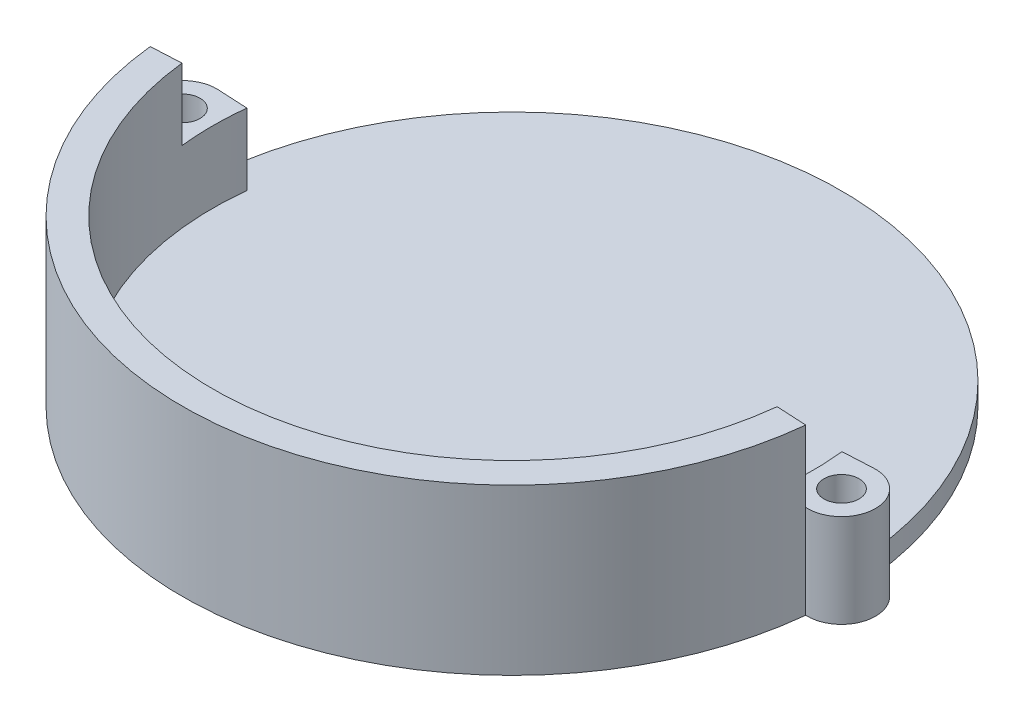
from build123d import *
from build123d.topology import SkipClean

# Parameters (mm, degrees)
SKETCH1_R           = 30
BOSS_EXTRUDE1_DEPTH = 2
SKETCH2_R           = 30
SKETCH2_R_2         = 27.25
BOSS_EXTRUDE2_DEPTH = 13
SKETCH6_W           = 70.354882949
SKETCH6_H           = 43.333649447
CUT_EXTRUDE4_DEPTH  = 13
BOSS_EXTRUDE3_DEPTH = 6.5
SKETCH8_R           = 1.6
CUT_EXTRUDE5_DEPTH  = 48.123348777
CUT_EXTRUDE6_DEPTH  = 6.5
SKETCH10_R          = 1.6
BOSS_EXTRUDE4_DEPTH = 2


with BuildPart() as part:
    # Sketch1 → Boss-Extrude1 (new body)
    with BuildSketch(Plane(origin=(0, 0, 0), x_dir=(1, 0, 0), z_dir=(0, 1, 0))):
        with Locations(Location((0, 0, 0), (0, 0, 270))):
            Circle(SKETCH1_R)
    extrude(amount=BOSS_EXTRUDE1_DEPTH)

    # Sketch2 → Boss-Extrude2 (add)
    with BuildSketch(Plane(origin=(0, 2, 0), x_dir=(1, 0, 0), z_dir=(0, 1, 0))):
        with Locations(Location((0, 0, 0), (0, 0, 270))):
            Circle(SKETCH2_R)
        with Locations(Location((0, 0, 0), (0, 0, 90))):
            Circle(SKETCH2_R_2, mode=Mode.SUBTRACT)
    extrude(amount=BOSS_EXTRUDE2_DEPTH)

    # Sketch6 → Cut-Extrude4 (cut)
    with BuildSketch(Plane(origin=(0, 15, 0), x_dir=(1, 0, 0), z_dir=(0, 1, 0))):
        with Locations((0.677303789, 21.666824724)):
            Rectangle(SKETCH6_W, SKETCH6_H)
    extrude(amount=-CUT_EXTRUDE4_DEPTH, mode=Mode.SUBTRACT)

    # Sketch7 → Boss-Extrude3 (add)
    with BuildSketch(Plane(origin=(0, 2, 0), x_dir=(1, 0, 0), z_dir=(0, 1, 0))):
        with BuildLine():
            Line((-29.839833333, -3.095859596), (-27.104515278, -2.812072466))
            ThreePointArc((-27.104515278, -2.812072466), (-27.249907122, 0.071146531), (-27.089461823, 2.95356702))
            Line((-27.089461823, 2.95356702), (-29.839833333, 3.095859596))
            ThreePointArc((-29.839833333, 3.095859596), (-33.1, 0), (-29.839833333, -3.095859596))
        make_face()
    boss_extrude3 = extrude(amount=BOSS_EXTRUDE3_DEPTH)

    # Sketch8 → Cut-Extrude5 (cut, through all)
    with BuildSketch(Plane(origin=(0, 15, 0), x_dir=(1, 0, 0), z_dir=(0, 1, 0))):
        with Locations(Location((-30, 0, 0), (0, 0, 271.528068595))):
            Circle(SKETCH8_R)
    cut_extrude5 = extrude(amount=-CUT_EXTRUDE5_DEPTH, mode=Mode.SUBTRACT)

    # Sketch9 → Cut-Extrude6 (cut)
    with BuildSketch(Plane(origin=(0, 15, 0), x_dir=(1, 0, 0), z_dir=(0, 1, 0))):
        Polygon((-29.839833333, -3.095859596), (27.24962849, -0.142292576), (-26.876929026, 0), (-30.387259787, 0), align=None)
    cut_extrude6 = extrude(amount=-CUT_EXTRUDE6_DEPTH, mode=Mode.SUBTRACT)

    # Sketch10 → Boss-Extrude4 (add)
    # profile 1 of 2: a face of its own
    with SkipClean():  # the faces are left unmerged after this step: merging them gives an invalid solid
        with BuildSketch(Plane.XZ):
            with BuildLine():
                Line((-29.839833333, -3.095859596), (-27.768095558, -1.6))
                Line((-27.768095558, -1.6), (-27.768095558, 1.42157282))
                Line((-27.768095558, 1.42157282), (-29.839833333, 3.095859596))
                ThreePointArc((-29.839833333, 3.095859596), (-33.1, 0), (-29.839833333, -3.095859596))
            make_face()
            with Locations(Location((-30, 0, 0), (0, 0, 90))):
                Circle(SKETCH10_R, mode=Mode.SUBTRACT)
        # profile 2 of 2: a face of its own
        with BuildSketch(Plane.XZ):
            with BuildLine():
                Line((27.768095558, 1.42157282), (29.839833333, 3.095859596))
                ThreePointArc((29.839833333, 3.095859596), (33.1, 0), (29.839833333, -3.095859596))
                Line((29.839833333, -3.095859596), (27.768095558, -1.6))
                Line((27.768095558, -1.6), (27.768095558, 1.42157282))
            make_face()
            with Locations((30, 0)):
                Circle(SKETCH10_R, mode=Mode.SUBTRACT)
        extrude(amount=-BOSS_EXTRUDE4_DEPTH)

    # Mirror2: Boss-Extrude3, Cut-Extrude5, Cut-Extrude6 across plane
    with SkipClean():  # the faces are left unmerged after this step: merging them gives an invalid solid
        add(boss_extrude3.mirror(Plane(origin=(0, 0, 0), x_dir=(0, 0, 1), z_dir=(1, 0, 0))))
        add(cut_extrude5.mirror(Plane(origin=(0, 0, 0), x_dir=(0, 0, 1), z_dir=(1, 0, 0))), mode=Mode.SUBTRACT)
        add(cut_extrude6.mirror(Plane(origin=(0, 0, 0), x_dir=(0, 0, 1), z_dir=(1, 0, 0))), mode=Mode.SUBTRACT)


solid = part.part
